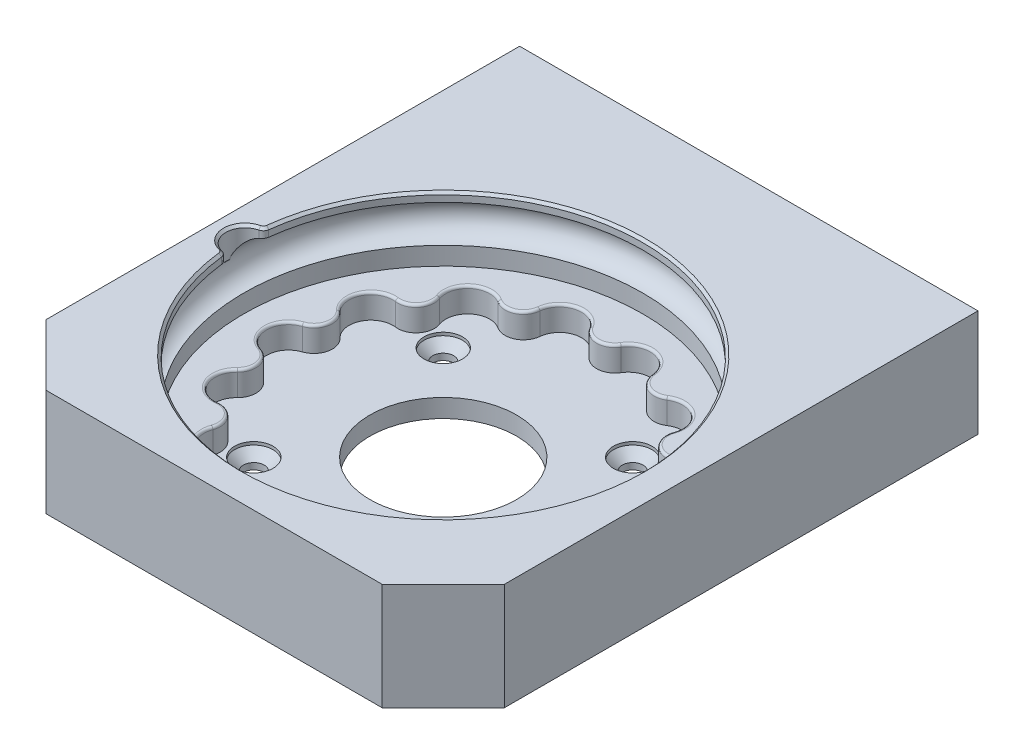
from build123d import *

# Parameters (mm, degrees)
SKETCH3_W                                    = 75
SKETCH3_H                                    = 75
SKETCH3_R                                    = 4.1
BOSS_EXTRUDE1_DEPTH                          = 3
SKETCH4_W                                    = 75
SKETCH4_H                                    = 75
SKETCH4_R                                    = 3
BOSS_EXTRUDE2_DEPTH                          = 4
SKETCH5_W                                    = 75
SKETCH5_H                                    = 75
SKETCH5_R                                    = 32.65
BOSS_EXTRUDE3_DEPTH                          = 10.5
CHAMFER1_SIZE                                = 10
SKETCH11_R                                   = 3.05
CUT_EXTRUDE2_START                           = -4.5
SKETCH12_R                                   = 3.1
CUT_EXTRUDE2_DEPTH                           = 4.5
FILLET2_R                                    = 1
SKETCH14_R                                   = 12
CUT_EXTRUDE3_DEPTH                           = 56.845769925
CSK_FOR_M3_COUNTERSUNK_FLAT_HEAD_SCR_2_COUNT = 2
CSK_FOR_M3_COUNTERSUNK_FLAT_HEAD_SCR_2_PITCH = 31
CSK_FOR_M3_COUNTERSUNK_FLAT_HEAD_SCR_3_COUNT = 2
CSK_FOR_M3_COUNTERSUNK_FLAT_HEAD_SCR_3_PITCH = 43.840620434
CSK_FOR_M3_COUNTERSUNK_FLAT_HEAD_SCR_4_COUNT = 2
CSK_FOR_M3_COUNTERSUNK_FLAT_HEAD_SCR_4_PITCH = 31
CHAMFER2_SIZE                                = 0.4
FILLET3_R                                    = 0.4
SKETCH17_W                                   = 75
SKETCH17_H                                   = 17.5
BOSS_EXTRUDE4_DEPTH                          = 12.5
SKETCH19_R                                   = 2.9
CUT_EXTRUDE4_DEPTH                           = 6.5
M4_CLEARANCE_HOLE1_D                         = 4.5
M4_CLEARANCE_HOLE1_DEPTH                     = 10
M4_CLEARANCE_HOLE1_TIP                       = 1.351936393


with BuildPart() as part:
    # Sketch3 → Boss-Extrude1 (new body)
    with BuildSketch(Plane(origin=(0, 0, 0), x_dir=(1, 0, 0), z_dir=(0, 1, 0))):
        Rectangle(SKETCH3_W, SKETCH3_H)
        with Locations(Location((0, 0, 0), (0, 0, 270))):
            Circle(SKETCH3_R, mode=Mode.SUBTRACT)
    extrude(amount=BOSS_EXTRUDE1_DEPTH)

    # Sketch4 → Boss-Extrude2 (add)
    # profile 1 of 15: a face of its own
    with BuildSketch(Plane(origin=(0, 3, 0), x_dir=(1, 0, 0), z_dir=(0, 1, 0))):
        Rectangle(SKETCH4_W, SKETCH4_H)
        with BuildLine():
            ThreePointArc((26.442208789, -3.408319866), (29.147644896, -3.81769999), (30.395474332, -6.252838244))
            ThreePointArc((30.395474332, -6.252838244), (28.561845083, -9.016817128), (25.302421485, -8.402054328))
            ThreePointArc((25.302421485, -8.402054328), (26.033152103, -12.5369053), (22.344792349, -14.543634511))
            ThreePointArc((22.344792349, -14.543634511), (24.219573885, -15.535873809), (24.969464657, -17.520063432))
            ThreePointArc((24.969464657, -17.520063432), (22.491548896, -20.474285504), (19.151179292, -18.548298619))
            ThreePointArc((19.151179292, -18.548298619), (18.015500229, -22.590722751), (13.821715745, -22.798403975))
            ThreePointArc((13.821715745, -22.798403975), (14.827351089, -23.883479748), (15.192133069, -25.317225188))
            ThreePointArc((15.192133069, -25.317225188), (12.043751311, -28.313553417), (9.206811167, -25.020824888))
            ThreePointArc((9.206811167, -25.020824888), (6.42965759, -28.170170503), (2.561078824, -26.537669928))
            ThreePointArc((2.561078824, -26.537669928), (2.888185977, -27.288592727), (3, -28.1))
            ThreePointArc((3, -28.1), (-0.811407273, -30.988185977), (-2.561078824, -26.537669928))
            ThreePointArc((-2.561078824, -26.537669928), (-6.42965759, -28.170170503), (-9.206811167, -25.020824888))
            ThreePointArc((-9.206811167, -25.020824888), (-9.195804841, -25.16884343), (-9.192133069, -25.317225188))
            ThreePointArc((-9.192133069, -25.317225188), (-13.625878509, -27.952443208), (-13.821715745, -22.798403975))
            ThreePointArc((-13.821715745, -22.798403975), (-18.015500229, -22.590722751), (-19.151179292, -18.548298619))
            ThreePointArc((-19.151179292, -18.548298619), (-24.314959105, -19.390532838), (-22.344792349, -14.543634511))
            ThreePointArc((-22.344792349, -14.543634511), (-26.033152103, -12.5369053), (-25.302421485, -8.402054328))
            ThreePointArc((-25.302421485, -8.402054328), (-30.320258069, -6.920401046), (-26.442208789, -3.408319866))
            ThreePointArc((-26.442208789, -3.408319866), (-28.894618926, 0), (-26.442208789, 3.408319866))
            ThreePointArc((-26.442208789, 3.408319866), (-30.320258069, 6.920401046), (-25.302421485, 8.402054328))
            ThreePointArc((-25.302421485, 8.402054328), (-26.033152103, 12.5369053), (-22.344792349, 14.543634511))
            ThreePointArc((-22.344792349, 14.543634511), (-24.314959105, 19.390532838), (-19.151179292, 18.548298619))
            ThreePointArc((-19.151179292, 18.548298619), (-18.015500229, 22.590722751), (-13.821715745, 22.798403975))
            ThreePointArc((-13.821715745, 22.798403975), (-13.625878509, 27.952443208), (-9.192133069, 25.317225188))
            ThreePointArc((-9.192133069, 25.317225188), (-9.195804841, 25.16884343), (-9.206811167, 25.020824888))
            ThreePointArc((-9.206811167, 25.020824888), (-6.42965759, 28.170170503), (-2.561078824, 26.537669928))
            ThreePointArc((-2.561078824, 26.537669928), (-0.811407273, 30.988185977), (3, 28.1))
            ThreePointArc((3, 28.1), (2.888185977, 27.288592727), (2.561078824, 26.537669928))
            ThreePointArc((2.561078824, 26.537669928), (6.42965759, 28.170170503), (9.206811167, 25.020824888))
            ThreePointArc((9.206811167, 25.020824888), (12.043751311, 28.313553417), (15.192133069, 25.317225188))
            ThreePointArc((15.192133069, 25.317225188), (14.827351089, 23.883479748), (13.821715745, 22.798403975))
            ThreePointArc((13.821715745, 22.798403975), (18.015500229, 22.590722751), (19.151179292, 18.548298619))
            ThreePointArc((19.151179292, 18.548298619), (22.491548896, 20.474285504), (24.969464657, 17.520063432))
            ThreePointArc((24.969464657, 17.520063432), (24.219573885, 15.535873809), (22.344792349, 14.543634511))
            ThreePointArc((22.344792349, 14.543634511), (26.033152103, 12.5369053), (25.302421485, 8.402054328))
            ThreePointArc((25.302421485, 8.402054328), (28.561845083, 9.016817128), (30.395474332, 6.252838244))
            ThreePointArc((30.395474332, 6.252838244), (29.147644896, 3.81769999), (26.442208789, 3.408319866))
            ThreePointArc((26.442208789, 3.408319866), (28.894618926, 0), (26.442208789, -3.408319866))
        make_face(mode=Mode.SUBTRACT)
    # profile 2 of 15: a face of its own
    with BuildSketch(Plane(origin=(0, 3, 0), x_dir=(1, 0, 0), z_dir=(0, 1, 0))):
        with Locations((21.969464657, 17.520063432)):
            Circle(SKETCH4_R)
    # profile 3 of 15: a face of its own
    with BuildSketch(Plane(origin=(0, 3, 0), x_dir=(1, 0, 0), z_dir=(0, 1, 0))):
        with Locations((27.395474332, 6.252838244)):
            Circle(SKETCH4_R)
    # profile 4 of 15: a face of its own
    with BuildSketch(Plane(origin=(0, 3, 0), x_dir=(1, 0, 0), z_dir=(0, 1, 0))):
        with Locations((27.395474332, -6.252838244)):
            Circle(SKETCH4_R)
    # profile 5 of 15: a face of its own
    with BuildSketch(Plane(origin=(0, 3, 0), x_dir=(1, 0, 0), z_dir=(0, 1, 0))):
        with Locations((21.969464657, -17.520063432)):
            Circle(SKETCH4_R)
    # profile 6 of 15: a face of its own
    with BuildSketch(Plane(origin=(0, 3, 0), x_dir=(1, 0, 0), z_dir=(0, 1, 0))):
        with Locations((12.192133069, -25.317225188)):
            Circle(SKETCH4_R)
    # profile 7 of 15: a face of its own
    with BuildSketch(Plane(origin=(0, 3, 0), x_dir=(1, 0, 0), z_dir=(0, 1, 0))):
        with Locations((0, -28.1)):
            Circle(SKETCH4_R)
    # profile 8 of 15: a face of its own
    with BuildSketch(Plane(origin=(0, 3, 0), x_dir=(1, 0, 0), z_dir=(0, 1, 0))):
        with Locations((-12.192133069, -25.317225188)):
            Circle(SKETCH4_R)
    # profile 9 of 15: a face of its own
    with BuildSketch(Plane(origin=(0, 3, 0), x_dir=(1, 0, 0), z_dir=(0, 1, 0))):
        with Locations((-21.969464657, -17.520063432)):
            Circle(SKETCH4_R)
    # profile 10 of 15: a face of its own
    with BuildSketch(Plane(origin=(0, 3, 0), x_dir=(1, 0, 0), z_dir=(0, 1, 0))):
        with Locations((-27.395474332, -6.252838244)):
            Circle(SKETCH4_R)
    # profile 11 of 15: a face of its own
    with BuildSketch(Plane(origin=(0, 3, 0), x_dir=(1, 0, 0), z_dir=(0, 1, 0))):
        with Locations((-27.395474332, 6.252838244)):
            Circle(SKETCH4_R)
    # profile 12 of 15: a face of its own
    with BuildSketch(Plane(origin=(0, 3, 0), x_dir=(1, 0, 0), z_dir=(0, 1, 0))):
        with Locations((-21.969464657, 17.520063432)):
            Circle(SKETCH4_R)
    # profile 13 of 15: a face of its own
    with BuildSketch(Plane(origin=(0, 3, 0), x_dir=(1, 0, 0), z_dir=(0, 1, 0))):
        with Locations((-12.192133069, 25.317225188)):
            Circle(SKETCH4_R)
    # profile 14 of 15: a face of its own
    with BuildSketch(Plane(origin=(0, 3, 0), x_dir=(1, 0, 0), z_dir=(0, 1, 0))):
        with Locations((0, 28.1)):
            Circle(SKETCH4_R)
    # profile 15 of 15: a face of its own
    with BuildSketch(Plane(origin=(0, 3, 0), x_dir=(1, 0, 0), z_dir=(0, 1, 0))):
        with Locations((12.192133069, 25.317225188)):
            Circle(SKETCH4_R)
    extrude(amount=BOSS_EXTRUDE2_DEPTH)

    # Sketch5 → Boss-Extrude3 (add)
    with BuildSketch(Plane(origin=(0, 7, 0), x_dir=(1, 0, 0), z_dir=(0, 1, 0))):
        Rectangle(SKETCH5_W, SKETCH5_H)
        with Locations(Location((0, 0, 0), (0, 0, 90))):
            Circle(SKETCH5_R, mode=Mode.SUBTRACT)
    extrude(amount=BOSS_EXTRUDE3_DEPTH)

    # Chamfer1
    chamfer1_edges = [part.edges().sort_by_distance(p)[0] for p in [
        (37.5, 8.75, 37.5),
        (-37.5, 8.75, 37.5),
    ]]
    chamfer(chamfer1_edges, length=CHAMFER1_SIZE)

    # Sketch11 → Cut-Revolve1 (revolve, cut)
    with BuildSketch(Plane.XY, mode=Mode.PRIVATE) as cut_revolve1_sk:
        with Locations((-32.45, 13)):
            Circle(SKETCH11_R)
    revolve(cut_revolve1_sk.sketch.rotate(Axis((0, 0, 0), (0, 1, 0)), 270), axis=Axis((0, 0, 0), (0, 1, 0)), mode=Mode.SUBTRACT)

    # Sketch12 → Cut-Extrude2 (cut)
    with BuildSketch(Plane(origin=(0, 17.5, 0), x_dir=(1, 0, 0), z_dir=(0, 1, 0)).offset(CUT_EXTRUDE2_START)):
        with Locations((-32.45, 0)):
            Circle(SKETCH12_R)
    extrude(amount=CUT_EXTRUDE2_DEPTH, mode=Mode.SUBTRACT)

    # Fillet2
    fillet2_edges = [part.edges().sort_by_distance(p)[0] for p in [
        (-32.502542373, 16.771717779, 3.099554694),
        (-32.502542373, 16.771717779, -3.099554694),
    ]]
    fillet(fillet2_edges, radius=FILLET2_R)

    # Sketch14 → Cut-Extrude3 (cut, through all)
    with BuildSketch(Plane.XZ):
        with Locations(Location((0, 0, 0), (0, 0, 270))):
            Circle(SKETCH14_R)
    extrude(amount=-CUT_EXTRUDE3_DEPTH, mode=Mode.SUBTRACT)

    # Sketch16 → CSK for M3 Countersunk Flat Head Screw1 (revolve, cut)
    with BuildSketch(Plane(origin=(-15.5, 3, -15.5), x_dir=(0, 0, 1), z_dir=(1, 0, 0))):
        Polygon((0, 0), (0, 3), (1.7, 3), (1.7, 1.95), (3.15, 0.5), (3.15, 0), align=None)
    csk_for_m3_countersunk_flat_head_screw1 = revolve(axis=Axis((-15.5, 9.35, -15.5), (0, -1, 0)), mode=Mode.SUBTRACT)

    # CSK for M3 Countersunk Flat Head Scr 2: CSK for M3 Countersunk Flat Head Screw1 ×2
    with Locations(*[(i * CSK_FOR_M3_COUNTERSUNK_FLAT_HEAD_SCR_2_PITCH, 0, 0) for i in range(1, CSK_FOR_M3_COUNTERSUNK_FLAT_HEAD_SCR_2_COUNT)]):
        add(csk_for_m3_countersunk_flat_head_screw1, mode=Mode.SUBTRACT)

    # CSK for M3 Countersunk Flat Head Scr 3: CSK for M3 Countersunk Flat Head Screw1 ×2
    with Locations(*[Vector(0.7071067811865476, 0, 0.7071067811865476) * (i * CSK_FOR_M3_COUNTERSUNK_FLAT_HEAD_SCR_3_PITCH) for i in range(1, CSK_FOR_M3_COUNTERSUNK_FLAT_HEAD_SCR_3_COUNT)]):
        add(csk_for_m3_countersunk_flat_head_screw1, mode=Mode.SUBTRACT)

    # CSK for M3 Countersunk Flat Head Scr 4: CSK for M3 Countersunk Flat Head Screw1 ×2
    with Locations(*[(0, 0, i * CSK_FOR_M3_COUNTERSUNK_FLAT_HEAD_SCR_4_PITCH) for i in range(1, CSK_FOR_M3_COUNTERSUNK_FLAT_HEAD_SCR_4_COUNT)]):
        add(csk_for_m3_countersunk_flat_head_screw1, mode=Mode.SUBTRACT)

    # Chamfer2
    chamfer2_edges = [part.edges().sort_by_distance(p)[0] for p in [
        (-35.55, 17.5, 0),
        (32.65, 17.5, 0),
        (-32.665461312, 17.5, -3.321237531),
        (-32.665461312, 17.5, 3.321237531),
    ]]
    chamfer(chamfer2_edges, length=CHAMFER2_SIZE)

    # Fillet3
    fillet3_edges = [part.edges().sort_by_distance(p)[0] for p in [
        (-26.033152103, 7, 12.5369053),
        (-28.894618926, 7, 0),
        (-26.033152103, 7, -12.5369053),
        (-18.015500229, 7, -22.590722751),
        (-6.42965759, 7, -28.170170503),
        (6.42965759, 7, -28.170170503),
        (18.015500229, 7, -22.590722751),
        (26.033152103, 7, -12.5369053),
        (28.894618926, 7, 0),
        (26.033152103, 7, 12.5369053),
        (18.015500229, 7, 22.590722751),
        (6.42965759, 7, 28.170170503),
        (-6.42965759, 7, 28.170170503),
        (-18.015500229, 7, 22.590722751),
        (-24.470690596, 7, 5.585275442),
        (-24.470690596, 7, -5.585275442),
        (-19.62397021, 7, -15.649594027),
        (-10.890481852, 7, -22.614318584),
        (0, 7, -25.1),
        (10.890481852, 7, -22.614318584),
        (19.62397021, 7, -15.649594027),
        (24.470690596, 7, -5.585275442),
        (24.470690596, 7, 5.585275442),
        (19.62397021, 7, 15.649594027),
        (10.890481852, 7, 22.614318584),
        (0, 7, 25.1),
        (-10.890481852, 7, 22.614318584),
        (-19.62397021, 7, 15.649594027),
    ]]
    fillet(fillet3_edges, radius=FILLET3_R)

    # Sketch17 → Boss-Extrude4 (add)
    with BuildSketch(Plane(origin=(0, 0, -37.5), x_dir=(-1, 0, 0), z_dir=(0, 0, -1))):
        with Locations((0, 8.75)):
            Rectangle(SKETCH17_W, SKETCH17_H)
    extrude(amount=BOSS_EXTRUDE4_DEPTH)

    # Sketch19 → Cut-Extrude4 (cut)
    with BuildSketch(Plane(origin=(0, 0, -50), x_dir=(-1, 0, 0), z_dir=(0, 0, -1))):
        with Locations((29, 9)):
            Circle(SKETCH19_R)
        with Locations((-29, 9)):
            Circle(SKETCH19_R)
    extrude(amount=-CUT_EXTRUDE4_DEPTH, mode=Mode.SUBTRACT)

    # M4 Clearance Hole1
    with Locations(Plane(origin=(0, 0, -50), x_dir=(-1, 0, 0), z_dir=(0, 0, -1))):
        with Locations((29, 9), (-29, 9)):
            Hole(M4_CLEARANCE_HOLE1_D / 2, depth=M4_CLEARANCE_HOLE1_DEPTH)
            with Locations((0, 0, -(M4_CLEARANCE_HOLE1_DEPTH + M4_CLEARANCE_HOLE1_TIP / 2))):  # 118° drill point
                Cone(0, M4_CLEARANCE_HOLE1_D / 2, M4_CLEARANCE_HOLE1_TIP, mode=Mode.SUBTRACT)


solid = part.part
